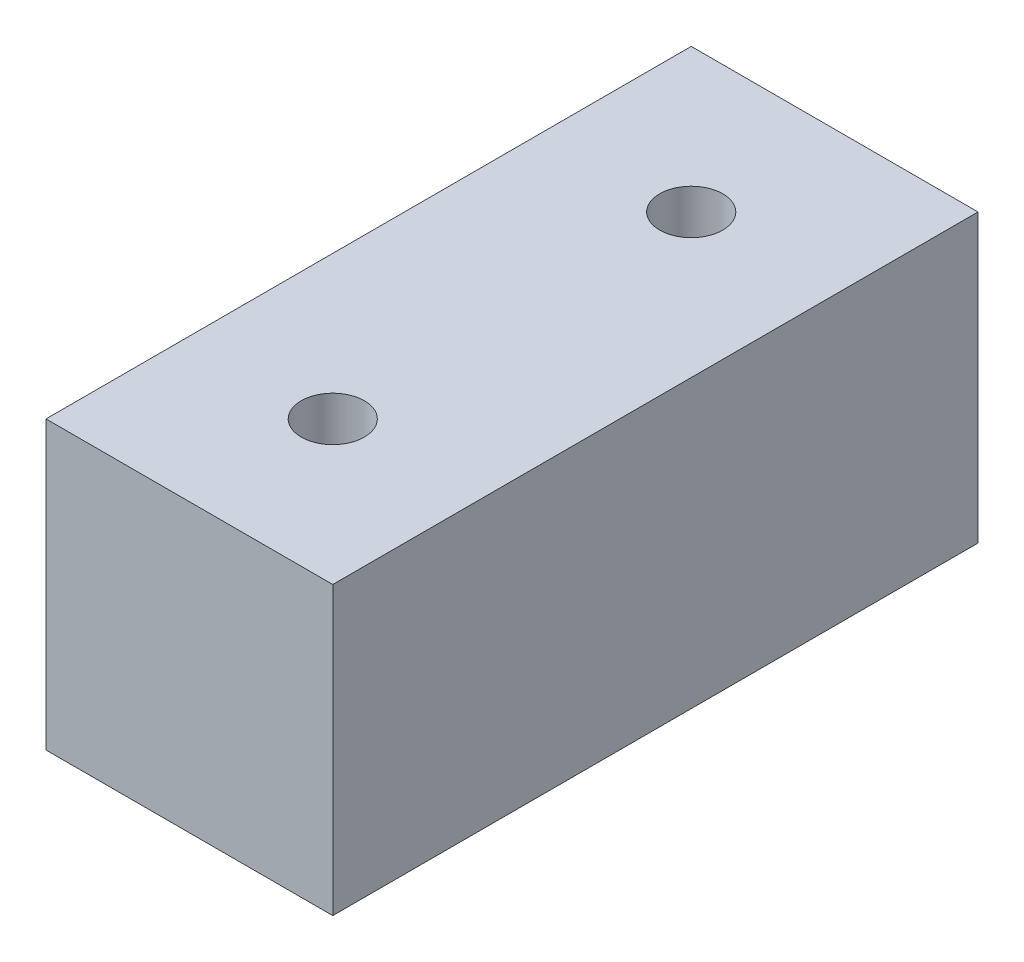
from build123d import *

# Parameters (mm, degrees)
SKETCH_1_W          = 20
SKETCH_1_H          = 20
EXTRUDE_1_DEPTH     = 45
SKETCH_2_R          = 2.2
CUT_EXTRUDE_1_DEPTH = 45


with BuildPart() as part:
    # 草图1 → 凸台-拉伸1 (new body)
    with BuildSketch(Plane.XY):
        Rectangle(SKETCH_1_W, SKETCH_1_H)
    extrude(amount=EXTRUDE_1_DEPTH)

    # 草图2 → 切除-拉伸1 (cut)
    with BuildSketch(Plane(origin=(0, 10, 0), x_dir=(1, 0, 0), z_dir=(0, 1, 0))):
        with Locations(Location((0, -10, 0), (0, 0, 270))):
            Circle(SKETCH_2_R)
        with Locations(Location((0, -35, 0), (0, 0, 270))):
            Circle(SKETCH_2_R)
    extrude(amount=-CUT_EXTRUDE_1_DEPTH, mode=Mode.SUBTRACT)


solid = part.part
